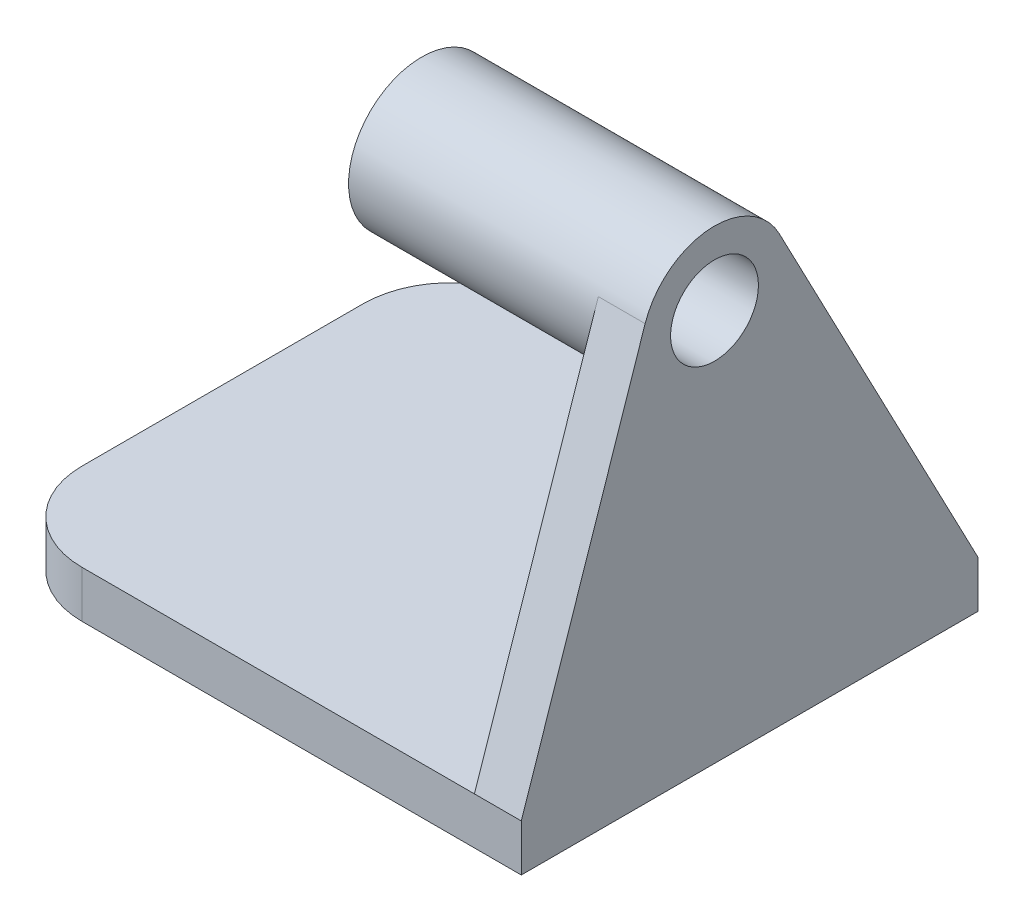
from build123d import *

# Parameters (mm, degrees)
SKETCH2_W           = 90
SKETCH2_H           = 78
BOSS_EXTRUDE1_DEPTH = 8
SKETCH3_R           = 12.5
SKETCH3_R_2         = 7.5
BOSS_EXTRUDE2_DEPTH = 50
BOSS_EXTRUDE3_DEPTH = 8
FILLET1_R           = 15
FILLET2_R           = 15


with BuildPart() as part:
    # Sketch2 → Boss-Extrude1 (new body)
    with BuildSketch(Plane(origin=(0, 0, 0), x_dir=(1, 0, 0), z_dir=(0, 1, 0))):
        with Locations((45, 39)):
            Rectangle(SKETCH2_W, SKETCH2_H)
    extrude(amount=BOSS_EXTRUDE1_DEPTH)



with BuildPart() as body_2:
    # Sketch3 → Boss-Extrude2 (new body)
    with BuildSketch(Plane(origin=(90, 0, 0), x_dir=(0, 0, -1), z_dir=(1, 0, 0))):
        with Locations((33, 67)):
            Circle(SKETCH3_R)
        with Locations((33, 67)):
            Circle(SKETCH3_R_2, mode=Mode.SUBTRACT)
    extrude(amount=-BOSS_EXTRUDE2_DEPTH)


with BuildPart() as part_1:
    add(part.part)

    add(body_2.part)  # Boss-Extrude3 merges body 2
    # Sketch4 → Boss-Extrude3 (add)
    with BuildSketch(Plane(origin=(90, 0, 0), x_dir=(0, 0, -1), z_dir=(1, 0, 0))):
        with BuildLine():
            Line((44.074003649, 72.797968885), (78, 8))
            Line((78, 8), (0, 8))
            Line((0, 8), (21.150362392, 70.979458323))
            ThreePointArc((21.150362392, 70.979458323), (33.988507549, 54.539147187), (44.074003649, 72.797968885))
        make_face()
    extrude(amount=-BOSS_EXTRUDE3_DEPTH)

    # Fillet1
    fillet1_edges = [part_1.edges().sort_by_distance(p)[0] for p in [
        (0, 4, 0),
    ]]
    fillet(fillet1_edges, radius=FILLET1_R)

    # Fillet2
    fillet2_edges = [part_1.edges().sort_by_distance(p)[0] for p in [
        (0, 4, -78),
    ]]
    fillet(fillet2_edges, radius=FILLET2_R)


solid = part_1.part
